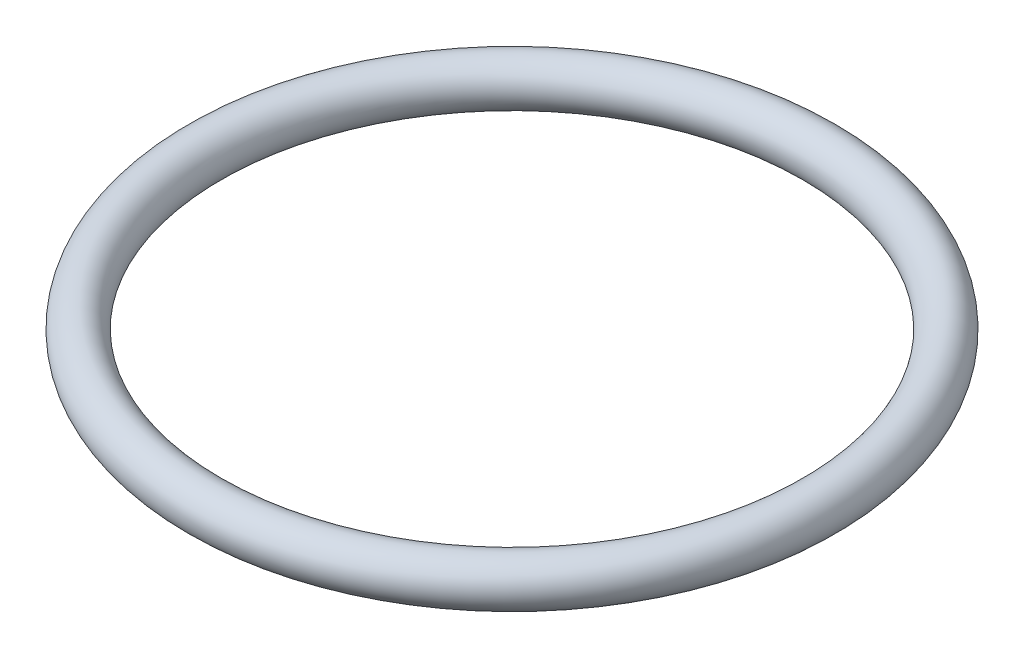
from build123d import *

# Parameters (mm, degrees)
SKETCH1_R = 1.7653


with BuildPart() as part:
    # Sketch1 → Revolve1 (revolve)
    with BuildSketch(Plane.XY, mode=Mode.PRIVATE) as revolve1_sk:
        with Locations((23.8125, 0)):
            Circle(SKETCH1_R)
    revolve(revolve1_sk.sketch.rotate(Axis((0, 0, 0), (0, 1, 0)), 90), axis=Axis((0, 0, 0), (0, 1, 0)))


solid = part.part
